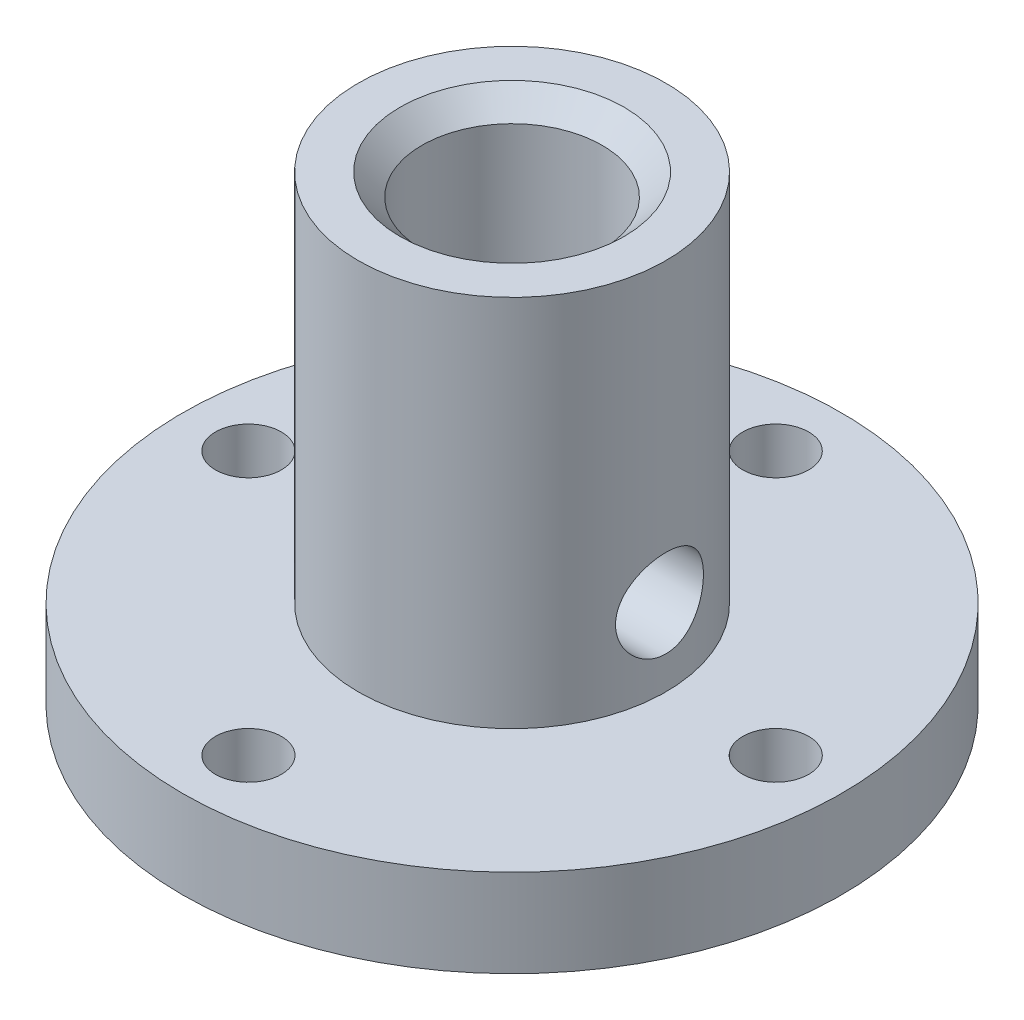
from build123d import *

# Parameters (mm, degrees)
SKETCH_1_R          = 15
SKETCH_1_R_2        = 4.1
EXTRUDE_1_DEPTH     = 4
SKETCH_2_R          = 7
SKETCH_2_R_2        = 4.1
EXTRUDE_2_DEPTH     = 17
SKETCH_5_R          = 2
CUT_EXTRUDE_1_DEPTH = 12
SKETCH_7_R          = 1.5
CUT_EXTRUDE_3_DEPTH = 4
CHAMFER_1_SIZE      = 1


with BuildPart() as part:
    # 草图1 → 凸台-拉伸1 (new body)
    with BuildSketch(Plane(origin=(0, 0, 0), x_dir=(1, 0, 0), z_dir=(0, 1, 0))):
        Circle(SKETCH_1_R)
        Circle(SKETCH_1_R_2, mode=Mode.SUBTRACT)
    extrude(amount=EXTRUDE_1_DEPTH)

    # 草图2 → 凸台-拉伸2 (add)
    with BuildSketch(Plane(origin=(0, 4, 0), x_dir=(1, 0, 0), z_dir=(0, 1, 0))):
        Circle(SKETCH_2_R)
        Circle(SKETCH_2_R_2, mode=Mode.SUBTRACT)
    extrude(amount=EXTRUDE_2_DEPTH)

    # 草图5 → 切除-拉伸1 (cut)
    with BuildSketch(Plane.ZY):
        with Locations((0, 7.5)):
            Circle(SKETCH_5_R)
    extrude(amount=-CUT_EXTRUDE_1_DEPTH, mode=Mode.SUBTRACT)

    # 草图7 → 切除-拉伸3 (cut)
    with BuildSketch(Plane(origin=(0, 4, 0), x_dir=(1, 0, 0), z_dir=(0, 1, 0))):
        with Locations((0, -12)):
            Circle(SKETCH_7_R)
        with Locations((-12, 0)):
            Circle(SKETCH_7_R)
        with Locations((0, 12)):
            Circle(SKETCH_7_R)
        with Locations((12, 0)):
            Circle(SKETCH_7_R)
    extrude(amount=-CUT_EXTRUDE_3_DEPTH, mode=Mode.SUBTRACT)

    # 倒角1
    chamfer_1_edges = [part.edges().sort_by_distance(p)[0] for p in [
        (-4.1, 21, 0),
    ]]
    chamfer(chamfer_1_edges, length=CHAMFER_1_SIZE)


solid = part.part
